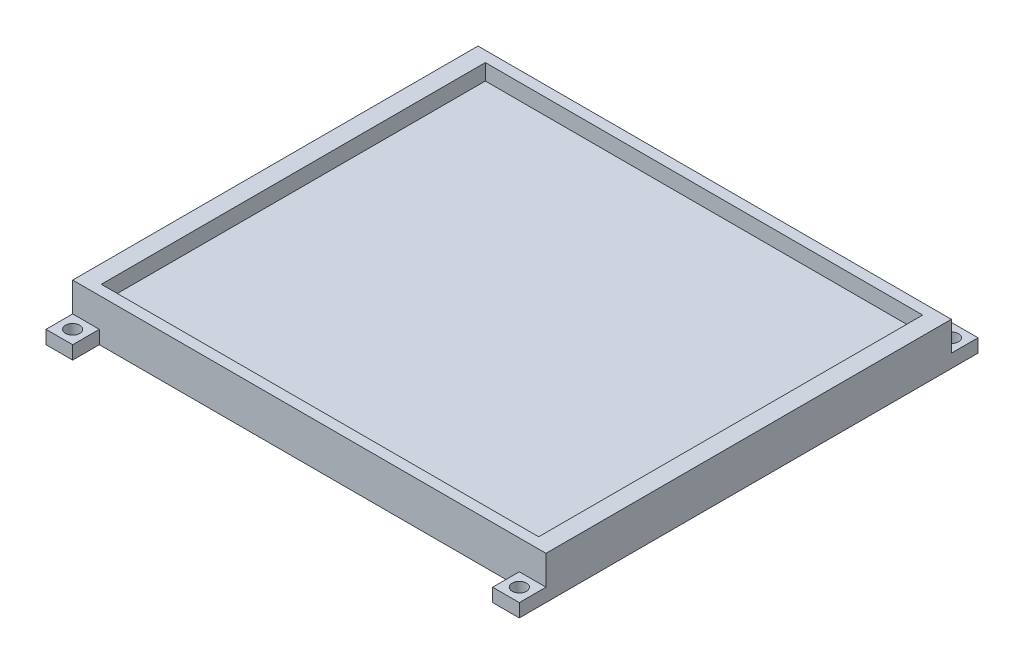
from build123d import *

# Parameters (mm, degrees)
SKETCH1_W           = 112.699999898
SKETCH1_H           = 96.52
BOSS_EXTRUDE1_DEPTH = 10.16
SKETCH2_W           = 104.14
SKETCH2_H           = 91.44
CUT_EXTRUDE1_DEPTH  = 3.81
SKETCH3_W           = 6.35
SKETCH3_H           = 6.35
SKETCH3_R           = 1.7
BOSS_EXTRUDE2_DEPTH = 3.175
SKETCH4_W           = 99.999999898
SKETCH4_H           = 83.82
CUT_EXTRUDE2_DEPTH  = 3.81


with BuildPart() as part:
    # Sketch1 → Boss-Extrude1 (new body)
    with BuildSketch(Plane(origin=(0, 0, 0), x_dir=(1, 0, 0), z_dir=(0, 1, 0))):
        with Locations((56.349999949, 48.26)):
            Rectangle(SKETCH1_W, SKETCH1_H)
    extrude(amount=BOSS_EXTRUDE1_DEPTH)

    # Sketch2 → Cut-Extrude1 (cut)
    with BuildSketch(Plane(origin=(0, 10.16, 0), x_dir=(1, 0, 0), z_dir=(0, 1, 0))):
        with Locations((56.349999949, 48.26)):
            Rectangle(SKETCH2_W, SKETCH2_H)
    extrude(amount=-CUT_EXTRUDE1_DEPTH, mode=Mode.SUBTRACT)

    # Sketch3 → Boss-Extrude2 (add)
    # profile 1 of 4: a face of its own
    with BuildSketch(Plane.XZ):
        with Locations((109.524999898, 3.175)):
            Rectangle(SKETCH3_W, SKETCH3_H)
        with Locations(Location((109.524999898, 3.175, 0), (0, 0, 270))):
            Circle(SKETCH3_R, mode=Mode.SUBTRACT)
    # profile 2 of 4: a face of its own
    with BuildSketch(Plane.XZ):
        with Locations((3.175, 3.175)):
            Rectangle(SKETCH3_W, SKETCH3_H)
        with Locations(Location((3.175, 3.175, 0), (0, 0, 270))):
            Circle(SKETCH3_R, mode=Mode.SUBTRACT)
    # profile 3 of 4: a face of its own
    with BuildSketch(Plane.XZ):
        with Locations((3.175, -99.695)):
            Rectangle(SKETCH3_W, SKETCH3_H)
        with Locations(Location((3.175, -99.695, 0), (0, 0, 270))):
            Circle(SKETCH3_R, mode=Mode.SUBTRACT)
    # profile 4 of 4: a face of its own
    with BuildSketch(Plane.XZ):
        with Locations((109.524999898, -99.695)):
            Rectangle(SKETCH3_W, SKETCH3_H)
        with Locations(Location((109.524999898, -99.695, 0), (0, 0, 270))):
            Circle(SKETCH3_R, mode=Mode.SUBTRACT)
    extrude(amount=-BOSS_EXTRUDE2_DEPTH)

    # Sketch4 → Cut-Extrude2 (cut)
    with BuildSketch(Plane.XZ):
        with Locations((56.349999949, -48.26)):
            Rectangle(SKETCH4_W, SKETCH4_H)
    extrude(amount=-CUT_EXTRUDE2_DEPTH, mode=Mode.SUBTRACT)


solid = part.part
